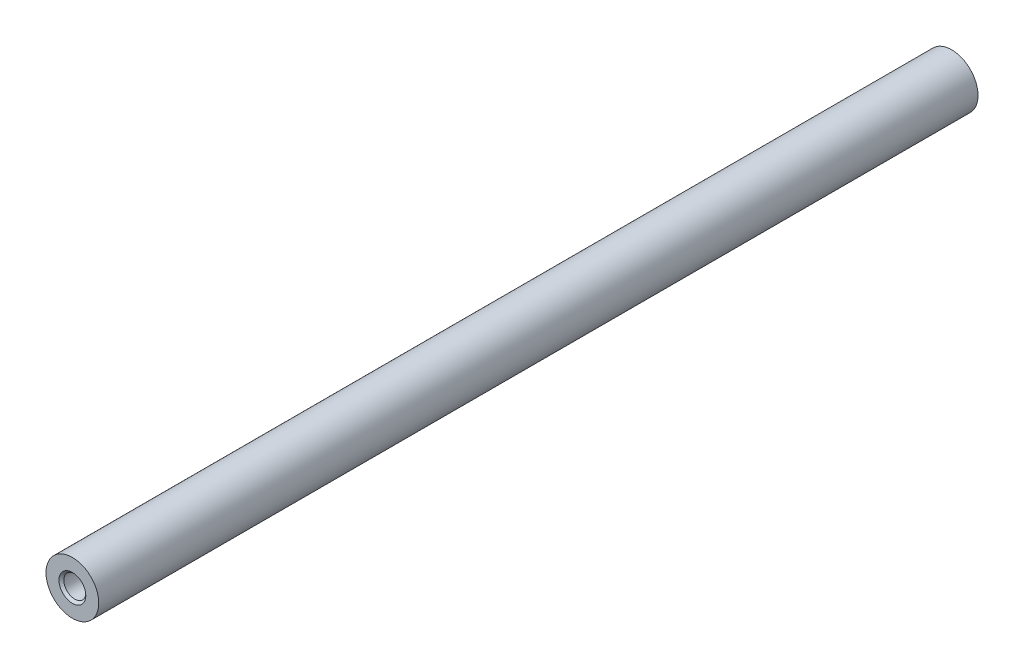
from build123d import *

# Parameters (mm, degrees)
SKETCH_1_R                   = 3
EXTRUDE_1_DEPTH              = 100
HOLE_WIZARD_M3_1_D           = 2.5
HOLE_WIZARD_M3_1_CSINK_D     = 3.05
HOLE_WIZARD_M3_1_CSINK_ANGLE = 90


with BuildPart() as part:
    # 草图1 → 凸台-拉伸1 (new body)
    with BuildSketch(Plane.XY):
        with Locations(Location((0, 0, 0), (0, 0, 180))):
            Circle(SKETCH_1_R)
    extrude(amount=EXTRUDE_1_DEPTH)

    # M3 螺纹孔1 (through all)
    with Locations(Plane.XY.offset(100)):
        with Locations((0, 0)):
            CounterSinkHole(HOLE_WIZARD_M3_1_D / 2, HOLE_WIZARD_M3_1_CSINK_D / 2, counter_sink_angle=HOLE_WIZARD_M3_1_CSINK_ANGLE)


solid = part.part
